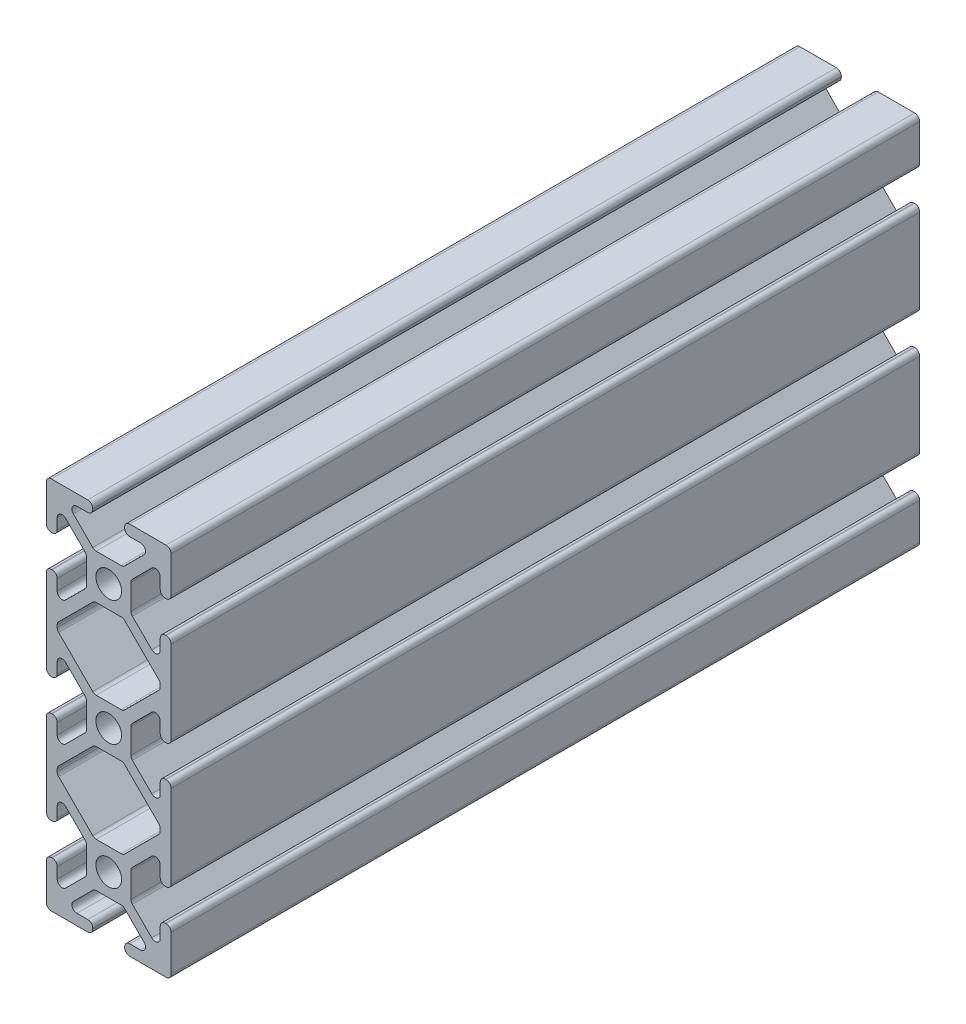
from build123d import *

# Parameters (mm, degrees)
SKETCH1_R            = 2.6035
MAIN_EXTRUSION_DEPTH = 76.2


with BuildPart() as part:
    # Sketch1 → Main Extrusion (new, symmetric)
    with BuildSketch(Plane.XY):
        with BuildLine():
            Line((-12.7, 37.084), (-12.7, 29.6672))
            ThreePointArc((-12.7, 29.6672), (-12.40242049, 28.94877951), (-11.684, 28.6512))
            Line((-11.684, 28.6512), (-11.5062, 28.6512))
            ThreePointArc((-11.5062, 28.6512), (-10.78777951, 28.94877951), (-10.4902, 29.6672))
            Line((-10.4902, 29.6672), (-10.4902, 31.874794456))
            ThreePointArc((-10.4902, 31.874794456), (-9.863006367, 32.813456061), (-8.75577951, 32.593214945))
            Line((-8.75577951, 32.593214945), (-4.81877951, 28.656214945))
            ThreePointArc((-4.81877951, 28.656214945), (-4.598538395, 28.326600823), (-4.5212, 27.937794456))
            Line((-4.5212, 27.937794456), (-4.5212, 22.862205544))
            ThreePointArc((-4.5212, 22.862205544), (-4.598538395, 22.473399177), (-4.81877951, 22.143785055))
            Line((-4.81877951, 22.143785055), (-8.75577951, 18.206785055))
            ThreePointArc((-8.75577951, 18.206785055), (-9.863006367, 17.986543939), (-10.4902, 18.925205544))
            Line((-10.4902, 18.925205544), (-10.4902, 21.1328))
            ThreePointArc((-10.4902, 21.1328), (-10.78777951, 21.85122049), (-11.5062, 22.1488))
            Line((-11.5062, 22.1488), (-11.684, 22.1488))
            ThreePointArc((-11.684, 22.1488), (-12.40242049, 21.85122049), (-12.7, 21.1328))
            Line((-12.7, 21.1328), (-12.7, 4.2672))
            ThreePointArc((-12.7, 4.2672), (-12.40242049, 3.54877951), (-11.684, 3.2512))
            Line((-11.684, 3.2512), (-11.5062, 3.2512))
            ThreePointArc((-11.5062, 3.2512), (-10.78777951, 3.54877951), (-10.4902, 4.2672))
            Line((-10.4902, 4.2672), (-10.4902, 6.474794456))
            ThreePointArc((-10.4902, 6.474794456), (-9.863006367, 7.413456061), (-8.75577951, 7.193214945))
            Line((-8.75577951, 7.193214945), (-4.81877951, 3.256214945))
            ThreePointArc((-4.81877951, 3.256214945), (-4.598538395, 2.926600823), (-4.5212, 2.537794456))
            Line((-4.5212, 2.537794456), (-4.5212, -2.537794456))
            ThreePointArc((-4.5212, -2.537794456), (-4.598538395, -2.926600823), (-4.81877951, -3.256214945))
            Line((-4.81877951, -3.256214945), (-8.75577951, -7.193214945))
            ThreePointArc((-8.75577951, -7.193214945), (-9.863006367, -7.413456061), (-10.4902, -6.474794456))
            Line((-10.4902, -6.474794456), (-10.4902, -4.2672))
            ThreePointArc((-10.4902, -4.2672), (-10.78777951, -3.54877951), (-11.5062, -3.2512))
            Line((-11.5062, -3.2512), (-11.684, -3.2512))
            ThreePointArc((-11.684, -3.2512), (-12.40242049, -3.54877951), (-12.7, -4.2672))
            Line((-12.7, -4.2672), (-12.7, -21.1328))
            ThreePointArc((-12.7, -21.1328), (-12.40242049, -21.85122049), (-11.684, -22.1488))
            Line((-11.684, -22.1488), (-11.5062, -22.1488))
            ThreePointArc((-11.5062, -22.1488), (-10.78777951, -21.85122049), (-10.4902, -21.1328))
            Line((-10.4902, -21.1328), (-10.4902, -18.925205544))
            ThreePointArc((-10.4902, -18.925205544), (-9.863006367, -17.986543939), (-8.75577951, -18.206785055))
            Line((-8.75577951, -18.206785055), (-4.81877951, -22.143785055))
            ThreePointArc((-4.81877951, -22.143785055), (-4.598538395, -22.473399177), (-4.5212, -22.862205544))
            Line((-4.5212, -22.862205544), (-4.5212, -27.937794456))
            ThreePointArc((-4.5212, -27.937794456), (-4.598538395, -28.326600823), (-4.81877951, -28.656214945))
            Line((-4.81877951, -28.656214945), (-8.75577951, -32.593214945))
            ThreePointArc((-8.75577951, -32.593214945), (-9.863006367, -32.813456061), (-10.4902, -31.874794456))
            Line((-10.4902, -31.874794456), (-10.4902, -29.6672))
            ThreePointArc((-10.4902, -29.6672), (-10.78777951, -28.94877951), (-11.5062, -28.6512))
            Line((-11.5062, -28.6512), (-11.684, -28.6512))
            ThreePointArc((-11.684, -28.6512), (-12.40242049, -28.94877951), (-12.7, -29.6672))
            Line((-12.7, -29.6672), (-12.7, -37.084))
            ThreePointArc((-12.7, -37.084), (-12.40242049, -37.80242049), (-11.684, -38.1))
            Line((-11.684, -38.1), (-4.2672, -38.1))
            ThreePointArc((-4.2672, -38.1), (-3.54877951, -37.80242049), (-3.2512, -37.084))
            Line((-3.2512, -37.084), (-3.2512, -36.9062))
            ThreePointArc((-3.2512, -36.9062), (-3.54877951, -36.18777951), (-4.2672, -35.8902))
            Line((-4.2672, -35.8902), (-6.474794456, -35.8902))
            ThreePointArc((-6.474794456, -35.8902), (-7.413456061, -35.263006367), (-7.193214945, -34.15577951))
            Line((-7.193214945, -34.15577951), (-3.256214945, -30.21877951))
            ThreePointArc((-3.256214945, -30.21877951), (-2.926600823, -29.998538395), (-2.537794456, -29.9212))
            Line((-2.537794456, -29.9212), (2.537794456, -29.9212))
            ThreePointArc((2.537794456, -29.9212), (2.926600823, -29.998538395), (3.256214945, -30.21877951))
            Line((3.256214945, -30.21877951), (7.193214945, -34.15577951))
            ThreePointArc((7.193214945, -34.15577951), (7.413456061, -35.263006367), (6.474794456, -35.8902))
            Line((6.474794456, -35.8902), (4.2672, -35.8902))
            ThreePointArc((4.2672, -35.8902), (3.54877951, -36.18777951), (3.2512, -36.9062))
            Line((3.2512, -36.9062), (3.2512, -37.084))
            ThreePointArc((3.2512, -37.084), (3.54877951, -37.80242049), (4.2672, -38.1))
            Line((4.2672, -38.1), (11.684, -38.1))
            ThreePointArc((11.684, -38.1), (12.40242049, -37.80242049), (12.7, -37.084))
            Line((12.7, -37.084), (12.7, -29.6672))
            ThreePointArc((12.7, -29.6672), (12.40242049, -28.94877951), (11.684, -28.6512))
            Line((11.684, -28.6512), (11.5062, -28.6512))
            ThreePointArc((11.5062, -28.6512), (10.78777951, -28.94877951), (10.4902, -29.6672))
            Line((10.4902, -29.6672), (10.4902, -31.874794456))
            ThreePointArc((10.4902, -31.874794456), (9.863006367, -32.813456061), (8.75577951, -32.593214945))
            Line((8.75577951, -32.593214945), (4.81877951, -28.656214945))
            ThreePointArc((4.81877951, -28.656214945), (4.598538395, -28.326600823), (4.5212, -27.937794456))
            Line((4.5212, -27.937794456), (4.5212, -22.862205544))
            ThreePointArc((4.5212, -22.862205544), (4.598538395, -22.473399177), (4.81877951, -22.143785055))
            Line((4.81877951, -22.143785055), (8.75577951, -18.206785055))
            ThreePointArc((8.75577951, -18.206785055), (9.863006367, -17.986543939), (10.4902, -18.925205544))
            Line((10.4902, -18.925205544), (10.4902, -21.1328))
            ThreePointArc((10.4902, -21.1328), (10.78777951, -21.85122049), (11.5062, -22.1488))
            Line((11.5062, -22.1488), (11.684, -22.1488))
            ThreePointArc((11.684, -22.1488), (12.40242049, -21.85122049), (12.7, -21.1328))
            Line((12.7, -21.1328), (12.7, -4.2672))
            ThreePointArc((12.7, -4.2672), (12.40242049, -3.54877951), (11.684, -3.2512))
            Line((11.684, -3.2512), (11.5062, -3.2512))
            ThreePointArc((11.5062, -3.2512), (10.78777951, -3.54877951), (10.4902, -4.2672))
            Line((10.4902, -4.2672), (10.4902, -6.474794456))
            ThreePointArc((10.4902, -6.474794456), (9.863006367, -7.413456061), (8.75577951, -7.193214945))
            Line((8.75577951, -7.193214945), (4.81877951, -3.256214945))
            ThreePointArc((4.81877951, -3.256214945), (4.598538395, -2.926600823), (4.5212, -2.537794456))
            Line((4.5212, -2.537794456), (4.5212, 2.537794456))
            ThreePointArc((4.5212, 2.537794456), (4.598538395, 2.926600823), (4.81877951, 3.256214945))
            Line((4.81877951, 3.256214945), (8.75577951, 7.193214945))
            ThreePointArc((8.75577951, 7.193214945), (9.863006367, 7.413456061), (10.4902, 6.474794456))
            Line((10.4902, 6.474794456), (10.4902, 4.2672))
            ThreePointArc((10.4902, 4.2672), (10.78777951, 3.54877951), (11.5062, 3.2512))
            Line((11.5062, 3.2512), (11.684, 3.2512))
            ThreePointArc((11.684, 3.2512), (12.40242049, 3.54877951), (12.7, 4.2672))
            Line((12.7, 4.2672), (12.7, 21.1328))
            ThreePointArc((12.7, 21.1328), (12.40242049, 21.85122049), (11.684, 22.1488))
            Line((11.684, 22.1488), (11.5062, 22.1488))
            ThreePointArc((11.5062, 22.1488), (10.78777951, 21.85122049), (10.4902, 21.1328))
            Line((10.4902, 21.1328), (10.4902, 18.925205544))
            ThreePointArc((10.4902, 18.925205544), (9.863006367, 17.986543939), (8.75577951, 18.206785055))
            Line((8.75577951, 18.206785055), (4.81877951, 22.143785055))
            ThreePointArc((4.81877951, 22.143785055), (4.598538395, 22.473399177), (4.5212, 22.862205544))
            Line((4.5212, 22.862205544), (4.5212, 27.937794456))
            ThreePointArc((4.5212, 27.937794456), (4.598538395, 28.326600823), (4.81877951, 28.656214945))
            Line((4.81877951, 28.656214945), (8.75577951, 32.593214945))
            ThreePointArc((8.75577951, 32.593214945), (9.863006367, 32.813456061), (10.4902, 31.874794456))
            Line((10.4902, 31.874794456), (10.4902, 29.6672))
            ThreePointArc((10.4902, 29.6672), (10.78777951, 28.94877951), (11.5062, 28.6512))
            Line((11.5062, 28.6512), (11.684, 28.6512))
            ThreePointArc((11.684, 28.6512), (12.40242049, 28.94877951), (12.7, 29.6672))
            Line((12.7, 29.6672), (12.7, 37.084))
            ThreePointArc((12.7, 37.084), (12.40242049, 37.80242049), (11.684, 38.1))
            Line((11.684, 38.1), (4.2672, 38.1))
            ThreePointArc((4.2672, 38.1), (3.54877951, 37.80242049), (3.2512, 37.084))
            Line((3.2512, 37.084), (3.2512, 36.9062))
            ThreePointArc((3.2512, 36.9062), (3.54877951, 36.18777951), (4.2672, 35.8902))
            Line((4.2672, 35.8902), (6.474794456, 35.8902))
            ThreePointArc((6.474794456, 35.8902), (7.413456061, 35.263006367), (7.193214945, 34.15577951))
            Line((7.193214945, 34.15577951), (3.256214945, 30.21877951))
            ThreePointArc((3.256214945, 30.21877951), (2.926600823, 29.998538395), (2.537794456, 29.9212))
            Line((2.537794456, 29.9212), (-2.537794456, 29.9212))
            ThreePointArc((-2.537794456, 29.9212), (-2.926600823, 29.998538395), (-3.256214945, 30.21877951))
            Line((-3.256214945, 30.21877951), (-7.193214945, 34.15577951))
            ThreePointArc((-7.193214945, 34.15577951), (-7.413456061, 35.263006367), (-6.474794456, 35.8902))
            Line((-6.474794456, 35.8902), (-4.2672, 35.8902))
            ThreePointArc((-4.2672, 35.8902), (-3.54877951, 36.18777951), (-3.2512, 36.9062))
            Line((-3.2512, 36.9062), (-3.2512, 37.084))
            ThreePointArc((-3.2512, 37.084), (-3.54877951, 37.80242049), (-4.2672, 38.1))
            Line((-4.2672, 38.1), (-11.684, 38.1))
            ThreePointArc((-11.684, 38.1), (-12.40242049, 37.80242049), (-12.7, 37.084))
        make_face()
        with Locations(Location((0, 25.4, 0), (0, 0, 180))):
            Circle(SKETCH1_R, mode=Mode.SUBTRACT)
        with Locations(Location((0, 0, 0), (0, 0, 180))):
            Circle(SKETCH1_R, mode=Mode.SUBTRACT)
        with Locations(Location((0, -25.4, 0), (0, 0, 180))):
            Circle(SKETCH1_R, mode=Mode.SUBTRACT)
        with BuildLine():
            Line((-10.4902, 12.473605544), (-10.4902, 12.926394456))
            ThreePointArc((-10.4902, 12.926394456), (-10.412861605, 13.315200823), (-10.19262049, 13.644814945))
            Line((-10.19262049, 13.644814945), (-3.256214945, 20.58122049))
            ThreePointArc((-3.256214945, 20.58122049), (-2.926600823, 20.801461605), (-2.537794456, 20.8788))
            Line((-2.537794456, 20.8788), (2.537794456, 20.8788))
            ThreePointArc((2.537794456, 20.8788), (2.926600823, 20.801461605), (3.256214945, 20.58122049))
            Line((3.256214945, 20.58122049), (10.19262049, 13.644814945))
            ThreePointArc((10.19262049, 13.644814945), (10.412861605, 13.315200823), (10.4902, 12.926394456))
            Line((10.4902, 12.926394456), (10.4902, 12.473605544))
            ThreePointArc((10.4902, 12.473605544), (10.412861605, 12.084799177), (10.19262049, 11.755185055))
            Line((10.19262049, 11.755185055), (3.256214945, 4.81877951))
            ThreePointArc((3.256214945, 4.81877951), (2.926600823, 4.598538395), (2.537794456, 4.5212))
            Line((2.537794456, 4.5212), (-2.537794456, 4.5212))
            ThreePointArc((-2.537794456, 4.5212), (-2.926600823, 4.598538395), (-3.256214945, 4.81877951))
            Line((-3.256214945, 4.81877951), (-10.19262049, 11.755185055))
            ThreePointArc((-10.19262049, 11.755185055), (-10.412861605, 12.084799177), (-10.4902, 12.473605544))
        make_face(mode=Mode.SUBTRACT)
        with BuildLine():
            Line((-2.537794456, -4.5212), (2.537794456, -4.5212))
            ThreePointArc((2.537794456, -4.5212), (2.926600823, -4.598538395), (3.256214945, -4.81877951))
            Line((3.256214945, -4.81877951), (10.19262049, -11.755185055))
            ThreePointArc((10.19262049, -11.755185055), (10.412861605, -12.084799177), (10.4902, -12.473605544))
            Line((10.4902, -12.473605544), (10.4902, -12.926394456))
            ThreePointArc((10.4902, -12.926394456), (10.412861605, -13.315200823), (10.19262049, -13.644814945))
            Line((10.19262049, -13.644814945), (3.256214945, -20.58122049))
            ThreePointArc((3.256214945, -20.58122049), (2.926600823, -20.801461605), (2.537794456, -20.8788))
            Line((2.537794456, -20.8788), (-2.537794456, -20.8788))
            ThreePointArc((-2.537794456, -20.8788), (-2.926600823, -20.801461605), (-3.256214945, -20.58122049))
            Line((-3.256214945, -20.58122049), (-10.19262049, -13.644814945))
            ThreePointArc((-10.19262049, -13.644814945), (-10.412861605, -13.315200823), (-10.4902, -12.926394456))
            Line((-10.4902, -12.926394456), (-10.4902, -12.473605544))
            ThreePointArc((-10.4902, -12.473605544), (-10.412861605, -12.084799177), (-10.19262049, -11.755185055))
            Line((-10.19262049, -11.755185055), (-3.256214945, -4.81877951))
            ThreePointArc((-3.256214945, -4.81877951), (-2.926600823, -4.598538395), (-2.537794456, -4.5212))
        make_face(mode=Mode.SUBTRACT)
    extrude(amount=MAIN_EXTRUSION_DEPTH, both=True)


solid = part.part
